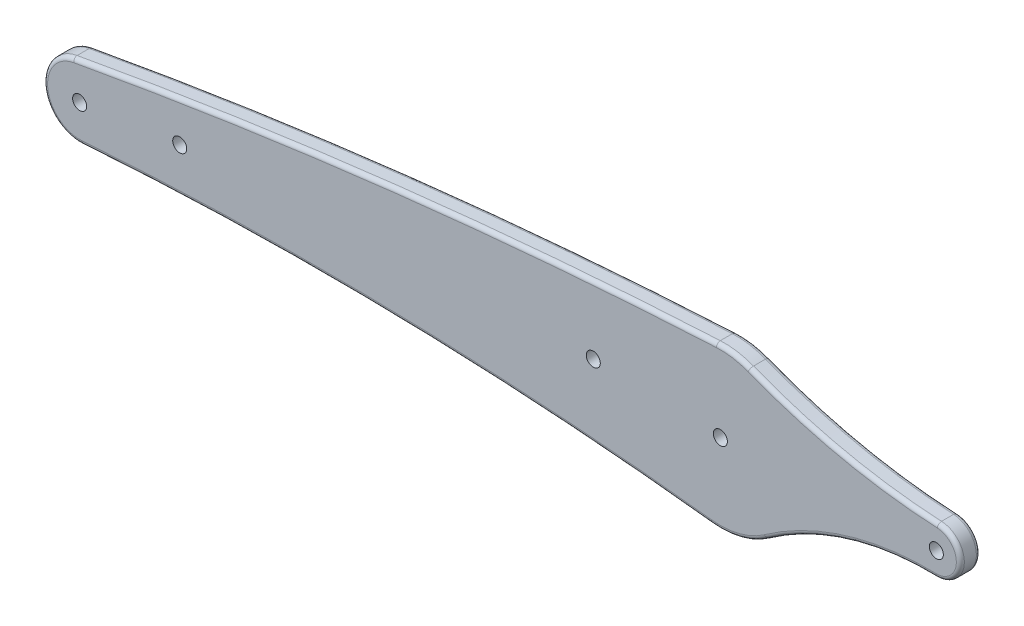
from build123d import *

# Parameters (mm, degrees)
SKETCH2_R           = 1.75
SKETCH2_R_2         = 9
SKETCH2_R_3         = 20
SKETCH2_R_4         = 10
SKETCH2_R_5         = 6
BOSS_EXTRUDE1_DEPTH = 2.5
FILLET1_R           = 1


with BuildPart() as part:
    # Sketch2 → Boss-Extrude1 (new, symmetric)
    # profile 1 of 6: a face of its own
    with BuildSketch(Plane.XY):
        with BuildLine():
            ThreePointArc((4.931171461, 183.44633077), (-12.782697282, 203.949164453), (6.192423965, 223.290625322))
            ThreePointArc((6.192423965, 223.290625322), (-74.438391307, 216.57190759), (-154.465632764, 204.650910815))
            ThreePointArc((-154.465632764, 204.650910815), (-147.086827714, 202.707602973), (-143.852204973, 195.796711203))
            ThreePointArc((-143.852204973, 195.796711203), (-146.265984708, 189.663057919), (-152.212583331, 186.819468634))
            ThreePointArc((-152.212583331, 186.819468634), (-73.562569521, 188.773026517), (4.931171461, 183.44633077))
        make_face()
        with Locations((-127.852204973, 199.130573991)):
            Circle(SKETCH2_R, mode=Mode.SUBTRACT)
        with Locations((-24.542709853, 204.413331435)):
            Circle(SKETCH2_R, mode=Mode.SUBTRACT)
    # profile 2 of 6: a face of its own
    with BuildSketch(Plane.XY):
        with Locations((-152.852204973, 195.796711203)):
            Circle(SKETCH2_R_2)
        with Locations((-152.852204973, 195.796711203)):
            Circle(SKETCH2_R, mode=Mode.SUBTRACT)
    # profile 3 of 6: a face of its own
    with BuildSketch(Plane.XY):
        with Locations((7.207290147, 203.316390753)):
            Circle(SKETCH2_R_3)
        with Locations((7.207290147, 203.316390753)):
            Circle(SKETCH2_R_4, mode=Mode.SUBTRACT)
    # profile 4 of 6: a face of its own
    with BuildSketch(Plane.XY):
        with Locations((7.207290147, 203.316390753)):
            Circle(SKETCH2_R_4)
        with Locations((7.207290147, 203.316390753)):
            Circle(SKETCH2_R, mode=Mode.SUBTRACT)
    # profile 5 of 6: a face of its own
    with BuildSketch(Plane.XY):
        with Locations((61.147795027, 205.850544138)):
            Circle(SKETCH2_R_5)
        with Locations((61.147795027, 205.850544138)):
            Circle(SKETCH2_R, mode=Mode.SUBTRACT)
    # profile 6 of 6: a face of its own
    with BuildSketch(Plane.XY):
        with BuildLine():
            ThreePointArc((14.489310329, 221.943580076), (23.724559953, 214.593792855), (27.207290147, 203.316390753))
            ThreePointArc((27.207290147, 203.316390753), (24.972572156, 194.129728945), (18.767814631, 186.99602698))
            ThreePointArc((18.767814631, 186.99602698), (38.842152118, 196.840042673), (60.99636255, 199.852455425))
            ThreePointArc((60.99636255, 199.852455425), (55.152157086, 206.079292207), (61.453820667, 211.842734748))
            ThreePointArc((61.453820667, 211.842734748), (37.564582261, 215.000863469), (14.489310329, 221.943580076))
        make_face()
    extrude(amount=BOSS_EXTRUDE1_DEPTH, both=True)

    # Fillet1
    fillet1_edges = [part.edges().sort_by_distance(p)[0] for p in [
        (10.412432506, 223.057896837, -2.5),
        (37.564582261, 215.000863469, -2.5),
        (67.143432968, 205.621796069, -2.5),
        (38.842152118, 196.840042673, -2.5),
        (12.177213039, 183.94373305, -2.5),
        (-73.562569521, 188.773026517, -2.5),
        (-161.781211479, 194.66850784, -2.5),
        (-74.438391307, 216.57190759, 2.5),
        (-74.438391307, 216.57190759, -2.5),
        (-161.781211479, 194.66850784, 2.5),
        (-73.562569521, 188.773026517, 2.5),
        (12.177213039, 183.94373305, 2.5),
        (38.842152118, 196.840042673, 2.5),
        (67.143432968, 205.621796069, 2.5),
        (37.564582261, 215.000863469, 2.5),
        (10.412432506, 223.057896837, 2.5),
    ]]
    fillet(fillet1_edges, radius=FILLET1_R)


solid = part.part
